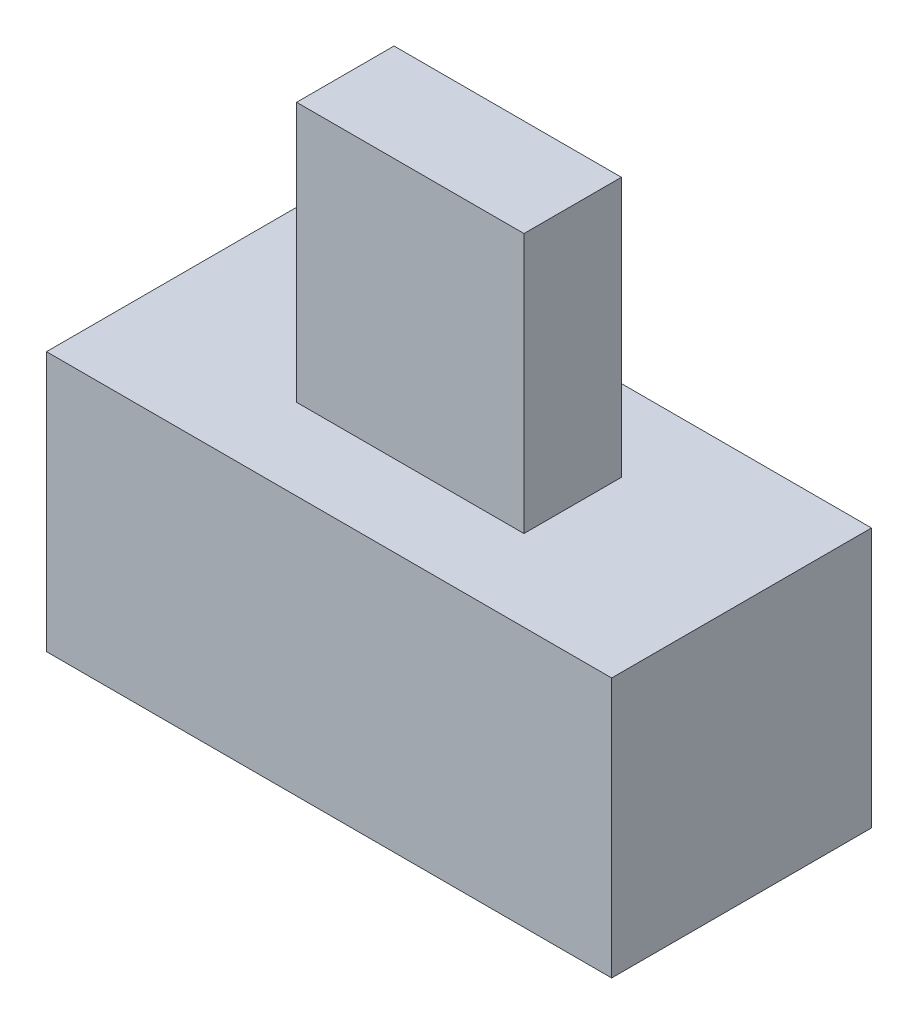
from build123d import *

# Parameters (mm, degrees)
SKETCH1_W           = 8.7
SKETCH1_H           = 4
BOSS_EXTRUDE1_DEPTH = 4
SKETCH2_W           = 3.5
SKETCH2_H           = 1.5
BOSS_EXTRUDE2_DEPTH = 4


with BuildPart() as part:
    # Sketch1 → Boss-Extrude1 (new body)
    with BuildSketch(Plane(origin=(0, 0, 0), x_dir=(1, 0, 0), z_dir=(0, 1, 0))):
        with Locations((4.35, 2)):
            Rectangle(SKETCH1_W, SKETCH1_H)
    extrude(amount=BOSS_EXTRUDE1_DEPTH)

    # Sketch2 → Boss-Extrude2 (add)
    with BuildSketch(Plane(origin=(0, 4, 0), x_dir=(1, 0, 0), z_dir=(0, 1, 0))):
        with Locations((4.35, 2)):
            Rectangle(SKETCH2_W, SKETCH2_H)
    extrude(amount=BOSS_EXTRUDE2_DEPTH)


solid = part.part
